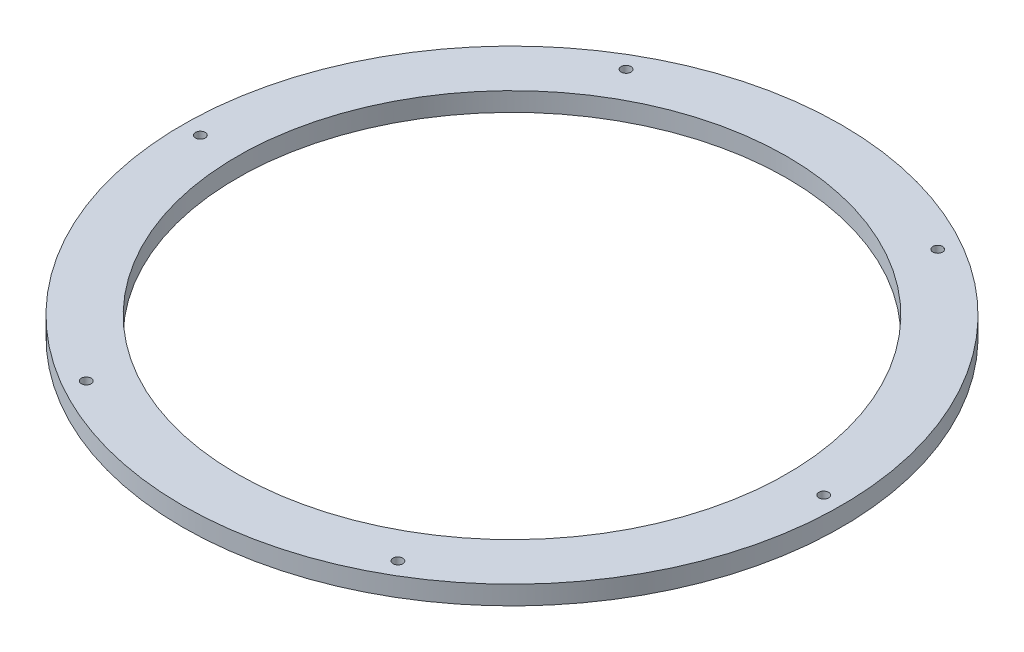
from build123d import *

# Parameters (mm, degrees)
SKETCH_1_R               = 175
SKETCH_1_R_2             = 146
EXTRUDE_1_DEPTH          = 10
SKETCH_2_R               = 2.6
CUT_EXTRUDE_1_DEPTH      = 248.68932153
PATTERN_CIRCULAR_1_COUNT = 6


with BuildPart() as part:
    # Эскиз1 → Бобышка-Вытянуть1 (new body)
    with BuildSketch(Plane(origin=(0, 0, 0), x_dir=(1, 0, 0), z_dir=(0, 1, 0))):
        with Locations(Location((0, 0, 0), (0, 0, 270))):
            Circle(SKETCH_1_R)
        with Locations(Location((0, 0, 0), (0, 0, 270))):
            Circle(SKETCH_1_R_2, mode=Mode.SUBTRACT)
    extrude(amount=EXTRUDE_1_DEPTH)

    # Эскиз2 → Вырез-Вытянуть1 (cut, through all)
    with BuildSketch(Plane(origin=(0, 10, 0), x_dir=(1, 0, 0), z_dir=(0, 1, 0))):
        with Locations(Location((-165.5, 0, 0), (0, 0, 270))):
            Circle(SKETCH_2_R)
    cut_extrude_1 = extrude(amount=-CUT_EXTRUDE_1_DEPTH, mode=Mode.SUBTRACT)

    # Круговой массив1: Вырез-Вытянуть1 ×6 about axis
    pattern_circular_1_axis = Axis((0, 0, 0), (0, 1, 0))
    for i in range(1, PATTERN_CIRCULAR_1_COUNT):
        add(cut_extrude_1.rotate(pattern_circular_1_axis, i * 360 / PATTERN_CIRCULAR_1_COUNT), mode=Mode.SUBTRACT)


solid = part.part
